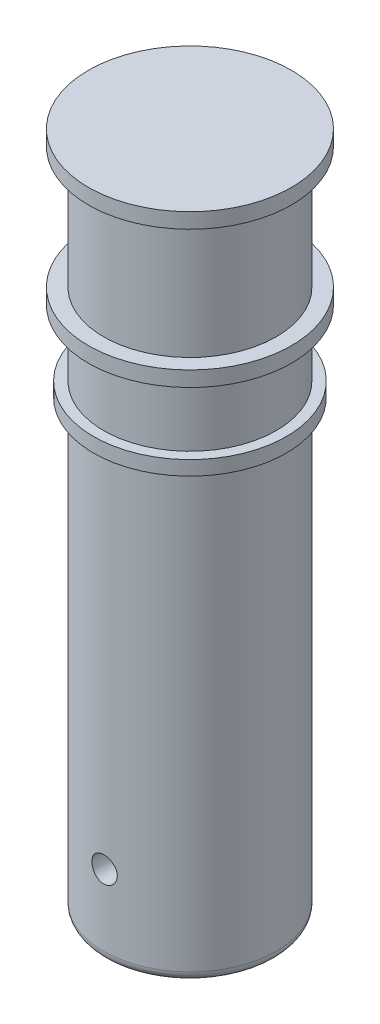
from build123d import *

# Parameters (mm, degrees)
FILLET1_R = 1
SKETCH3_W = 1.25
SKETCH3_H = 8.5


with BuildPart() as part:
    # Sketch1 → Revolve1 (revolve)
    with BuildSketch(Plane.XY):
        Polygon((-8.5, -51.915), (-8.5, -7.915), (-9.5, -7.915), (-9.5, -6.5), (-8.5, -6.5), (-8.5, 0), (-10, 0), (-10, 1.5), (-8.5, 1.5), (-8.5, 13.5), (-10, 13.5), (-10, 15), (0, 15), (0, -37.915), (-4, -37.915), (-4, -51.915), align=None)
    revolve(axis=Axis((0, 15, 0), (0, -1, 0)))

    # Fillet1
    fillet1_edges = [part.edges().sort_by_distance(p)[0] for p in [
        (8.5, -51.915, 0),
        (4, -51.915, 0),
    ]]
    fillet(fillet1_edges, radius=FILLET1_R)

    # Sketch3 → M3x0.5 Tapped Hole1 (revolve, cut)
    with BuildSketch(Plane(origin=(0, -43.915, 0), x_dir=(0, 1, 0), z_dir=(1, 0, 0))):
        with Locations((0.625, 4.25)):
            Rectangle(SKETCH3_W, SKETCH3_H)
    revolve(axis=Axis((0, -43.915, -6.35), (0, 0, 1)), mode=Mode.SUBTRACT)


solid = part.part
